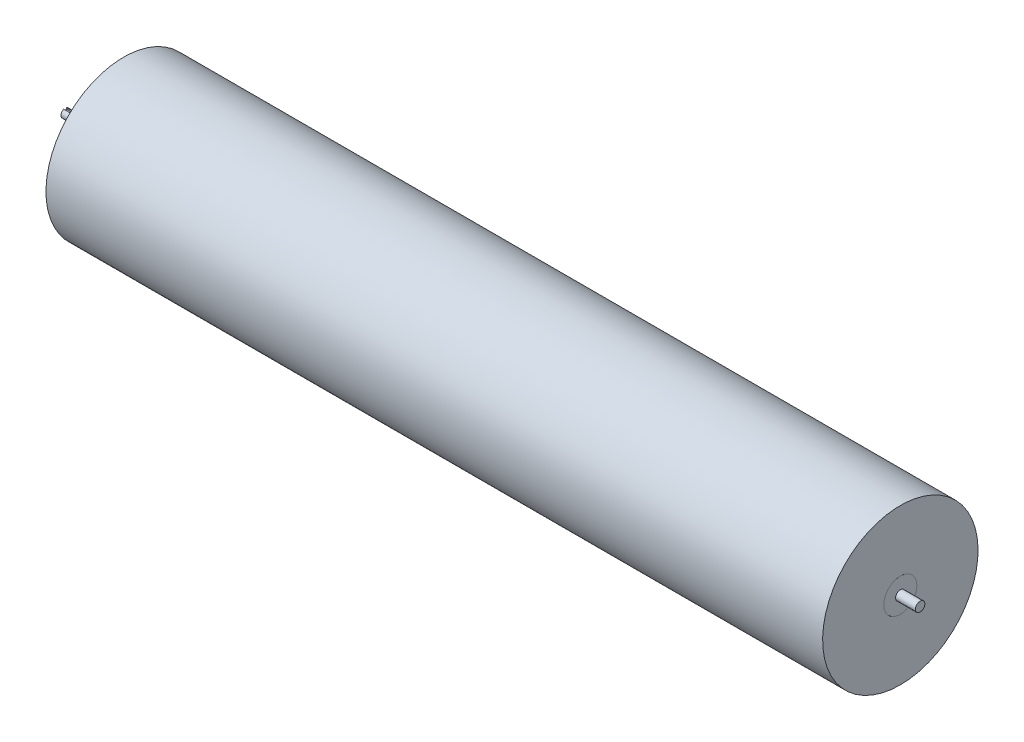
from build123d import *

# Parameters (mm, degrees)
SKETCH1_W           = 1649
SKETCH1_H           = 129.8995
SKETCH2_R           = 35.1
SKETCH2_R_2         = 10.0005
BOSS_EXTRUDE1_DEPTH = 10
SKETCH3_R           = 35.1
SKETCH3_R_2         = 10.0005
BOSS_EXTRUDE2_DEPTH = 10
CUT_EXTRUDE1_DEPTH  = 3.5


with BuildPart() as part:
    # Sketch1 → Revolve1 (revolve)
    with BuildSketch(Plane.XY, mode=Mode.PRIVATE) as revolve1_sk:
        with Locations((0, 100.05025)):
            Rectangle(SKETCH1_W, SKETCH1_H)
    revolve(revolve1_sk.sketch.rotate(Axis((-824.5, 0, 0), (1, 0, 0)), 180), axis=Axis((-824.5, 0, 0), (1, 0, 0)))


with BuildPart() as body_2:
    # Sketch2 → Boss-Extrude1 (new body)
    with BuildSketch(Plane.ZY.offset(824.5)):
        with Locations(Location((0, 0, 0), (0, 0, 270))):
            Circle(SKETCH2_R)
        with Locations(Location((0, 0, 0), (0, 0, 270))):
            Circle(SKETCH2_R_2, mode=Mode.SUBTRACT)
    extrude(amount=-BOSS_EXTRUDE1_DEPTH)


with BuildPart() as body_3:
    # Sketch3 → Boss-Extrude2 (new body)
    with BuildSketch(Plane(origin=(824.5, 0, 0), x_dir=(0, 0, -1), z_dir=(1, 0, 0))):
        with Locations(Location((0, 0, 0), (0, 0, 90))):
            Circle(SKETCH3_R)
        with Locations(Location((0, 0, 0), (0, 0, 90))):
            Circle(SKETCH3_R_2, mode=Mode.SUBTRACT)
    extrude(amount=-BOSS_EXTRUDE2_DEPTH)


with BuildPart() as body_4:
    # Sketch4 → Revolve3 (revolve)
    with BuildSketch(Plane.XY, mode=Mode.PRIVATE) as revolve3_sk:
        Polygon((-866.5, 10), (866.5, 10), (866.5, 0), (-948.8, 0), (-948.8, 9), (-866.5, 9), align=None)
    revolve(revolve3_sk.sketch.rotate(Axis((-948.8, 0, 0), (1, 0, 0)), 180), axis=Axis((-948.8, 0, 0), (1, 0, 0)))

    # Sketch5 → Cut-Extrude1 (cut)
    with BuildSketch(Plane(origin=(0, 9, 0), x_dir=(1, 0, 0), z_dir=(0, 1, 0))):
        with BuildLine():
            Line((-948.8, 3), (-898.8, 3))
            ThreePointArc((-898.8, 3), (-895.8, 0), (-898.8, -3))
            Line((-898.8, -3), (-948.8, -3))
            Line((-948.8, -3), (-948.8, 3))
        make_face()
    extrude(amount=-CUT_EXTRUDE1_DEPTH, mode=Mode.SUBTRACT)


solid = Compound([part.part, body_2.part, body_3.part, body_4.part])
